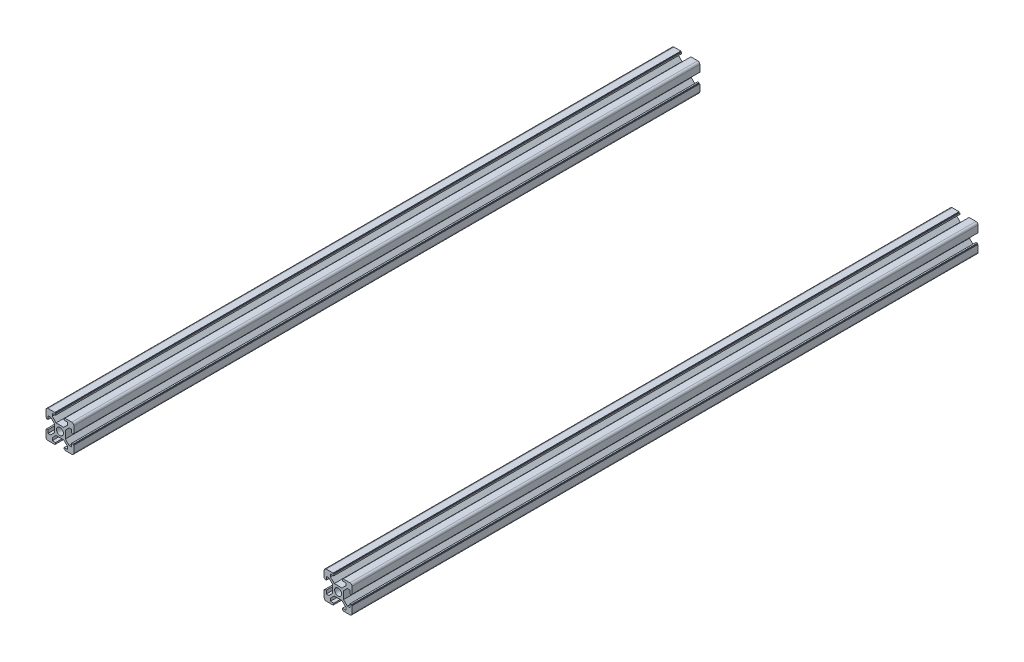
from build123d import *

# Parameters (mm, degrees)
SKETCH1_R                  = 2.5
F_20_X_20_X_R1_5_1_DEPTH   = 450
SKETCH1_ON_SEGMENT_2_R     = 2.5
F_20_X_20_X_R1_5_1_2_DEPTH = 450


with BuildPart() as part:
    # Sketch1 → 工业铝型材 20 X 20 X R1.5(1) (new body)
    with BuildSketch(Plane(origin=(0, 0, 0), x_dir=(1, 0, 0), z_dir=(0, 0, -1))):
        with BuildLine():
            Line((-3.6, 10), (-3.6, 9.5))
            Line((-3.6, 9.5), (-3.1, 9.5))
            Line((-3.1, 9.5), (-3.1, 8.5))
            Line((-3.1, 8.5), (-5.5, 8.5))
            Line((-5.5, 8.5), (-5.5, 6.65))
            Line((-5.5, 6.65), (-2.75, 3.9))
            Line((-2.75, 3.9), (2.75, 3.9))
            Line((2.75, 3.9), (5.5, 6.65))
            Line((5.5, 6.65), (5.5, 8.5))
            Line((5.5, 8.5), (3.1, 8.5))
            Line((3.1, 8.5), (3.1, 9.5))
            Line((3.1, 9.5), (3.6, 9.5))
            Line((3.6, 9.5), (3.6, 10))
            Line((3.6, 10), (8.5, 10))
            ThreePointArc((8.5, 10), (9.560660172, 9.560660172), (10, 8.5))
            Line((10, 8.5), (10, 3.6))
            Line((10, 3.6), (9.5, 3.6))
            Line((9.5, 3.6), (9.5, 3.1))
            Line((9.5, 3.1), (8.5, 3.1))
            Line((8.5, 3.1), (8.5, 5.5))
            Line((8.5, 5.5), (6.65, 5.5))
            Line((6.65, 5.5), (3.9, 2.75))
            Line((3.9, 2.75), (3.9, -2.75))
            Line((3.9, -2.75), (6.65, -5.5))
            Line((6.65, -5.5), (8.5, -5.5))
            Line((8.5, -5.5), (8.5, -3.1))
            Line((8.5, -3.1), (9.5, -3.1))
            Line((9.5, -3.1), (9.5, -3.6))
            Line((9.5, -3.6), (10, -3.6))
            Line((10, -3.6), (10, -8.5))
            ThreePointArc((10, -8.5), (9.560660172, -9.560660172), (8.5, -10))
            Line((8.5, -10), (3.6, -10))
            Line((3.6, -10), (3.6, -9.5))
            Line((3.6, -9.5), (3.1, -9.5))
            Line((3.1, -9.5), (3.1, -8.5))
            Line((3.1, -8.5), (5.5, -8.5))
            Line((5.5, -8.5), (5.5, -6.65))
            Line((5.5, -6.65), (2.75, -3.9))
            Line((2.75, -3.9), (-2.75, -3.9))
            Line((-2.75, -3.9), (-5.5, -6.65))
            Line((-5.5, -6.65), (-5.5, -8.5))
            Line((-5.5, -8.5), (-3.1, -8.5))
            Line((-3.1, -8.5), (-3.1, -9.5))
            Line((-3.1, -9.5), (-3.6, -9.5))
            Line((-3.6, -9.5), (-3.6, -10))
            Line((-3.6, -10), (-8.5, -10))
            ThreePointArc((-8.5, -10), (-9.560660172, -9.560660172), (-10, -8.5))
            Line((-10, -8.5), (-10, -3.6))
            Line((-10, -3.6), (-9.5, -3.6))
            Line((-9.5, -3.6), (-9.5, -3.1))
            Line((-9.5, -3.1), (-8.5, -3.1))
            Line((-8.5, -3.1), (-8.5, -5.5))
            Line((-8.5, -5.5), (-6.65, -5.5))
            Line((-6.65, -5.5), (-3.9, -2.75))
            Line((-3.9, -2.75), (-3.9, 2.75))
            Line((-3.9, 2.75), (-6.65, 5.5))
            Line((-6.65, 5.5), (-8.5, 5.5))
            Line((-8.5, 5.5), (-8.5, 3.1))
            Line((-8.5, 3.1), (-9.5, 3.1))
            Line((-9.5, 3.1), (-9.5, 3.6))
            Line((-9.5, 3.6), (-10, 3.6))
            Line((-10, 3.6), (-10, 8.5))
            ThreePointArc((-10, 8.5), (-9.560660172, 9.560660172), (-8.5, 10))
            Line((-8.5, 10), (-3.6, 10))
        make_face()
        Circle(SKETCH1_R, mode=Mode.SUBTRACT)
    extrude(amount=F_20_X_20_X_R1_5_1_DEPTH)


with BuildPart() as body_2:
    # Sketch1 on segment 2 (carried to segment 2) → 20 X 20 X R1.5_1 2 (new body)
    with BuildSketch(Plane(origin=(200, 0, 0), x_dir=(1, 0, 0), z_dir=(0, 0, -1))):
        with BuildLine():
            Line((-3.6, 10), (-3.6, 9.5))
            Line((-3.6, 9.5), (-3.1, 9.5))
            Line((-3.1, 9.5), (-3.1, 8.5))
            Line((-3.1, 8.5), (-5.5, 8.5))
            Line((-5.5, 8.5), (-5.5, 6.65))
            Line((-5.5, 6.65), (-2.75, 3.9))
            Line((-2.75, 3.9), (2.75, 3.9))
            Line((2.75, 3.9), (5.5, 6.65))
            Line((5.5, 6.65), (5.5, 8.5))
            Line((5.5, 8.5), (3.1, 8.5))
            Line((3.1, 8.5), (3.1, 9.5))
            Line((3.1, 9.5), (3.6, 9.5))
            Line((3.6, 9.5), (3.6, 10))
            Line((3.6, 10), (8.5, 10))
            ThreePointArc((8.5, 10), (9.560660172, 9.560660172), (10, 8.5))
            Line((10, 8.5), (10, 3.6))
            Line((10, 3.6), (9.5, 3.6))
            Line((9.5, 3.6), (9.5, 3.1))
            Line((9.5, 3.1), (8.5, 3.1))
            Line((8.5, 3.1), (8.5, 5.5))
            Line((8.5, 5.5), (6.65, 5.5))
            Line((6.65, 5.5), (3.9, 2.75))
            Line((3.9, 2.75), (3.9, -2.75))
            Line((3.9, -2.75), (6.65, -5.5))
            Line((6.65, -5.5), (8.5, -5.5))
            Line((8.5, -5.5), (8.5, -3.1))
            Line((8.5, -3.1), (9.5, -3.1))
            Line((9.5, -3.1), (9.5, -3.6))
            Line((9.5, -3.6), (10, -3.6))
            Line((10, -3.6), (10, -8.5))
            ThreePointArc((10, -8.5), (9.560660172, -9.560660172), (8.5, -10))
            Line((8.5, -10), (3.6, -10))
            Line((3.6, -10), (3.6, -9.5))
            Line((3.6, -9.5), (3.1, -9.5))
            Line((3.1, -9.5), (3.1, -8.5))
            Line((3.1, -8.5), (5.5, -8.5))
            Line((5.5, -8.5), (5.5, -6.65))
            Line((5.5, -6.65), (2.75, -3.9))
            Line((2.75, -3.9), (-2.75, -3.9))
            Line((-2.75, -3.9), (-5.5, -6.65))
            Line((-5.5, -6.65), (-5.5, -8.5))
            Line((-5.5, -8.5), (-3.1, -8.5))
            Line((-3.1, -8.5), (-3.1, -9.5))
            Line((-3.1, -9.5), (-3.6, -9.5))
            Line((-3.6, -9.5), (-3.6, -10))
            Line((-3.6, -10), (-8.5, -10))
            ThreePointArc((-8.5, -10), (-9.560660172, -9.560660172), (-10, -8.5))
            Line((-10, -8.5), (-10, -3.6))
            Line((-10, -3.6), (-9.5, -3.6))
            Line((-9.5, -3.6), (-9.5, -3.1))
            Line((-9.5, -3.1), (-8.5, -3.1))
            Line((-8.5, -3.1), (-8.5, -5.5))
            Line((-8.5, -5.5), (-6.65, -5.5))
            Line((-6.65, -5.5), (-3.9, -2.75))
            Line((-3.9, -2.75), (-3.9, 2.75))
            Line((-3.9, 2.75), (-6.65, 5.5))
            Line((-6.65, 5.5), (-8.5, 5.5))
            Line((-8.5, 5.5), (-8.5, 3.1))
            Line((-8.5, 3.1), (-9.5, 3.1))
            Line((-9.5, 3.1), (-9.5, 3.6))
            Line((-9.5, 3.6), (-10, 3.6))
            Line((-10, 3.6), (-10, 8.5))
            ThreePointArc((-10, 8.5), (-9.560660172, 9.560660172), (-8.5, 10))
            Line((-8.5, 10), (-3.6, 10))
        make_face()
        Circle(SKETCH1_ON_SEGMENT_2_R, mode=Mode.SUBTRACT)
    extrude(amount=F_20_X_20_X_R1_5_1_2_DEPTH)


solid = Compound([part.part, body_2.part])
